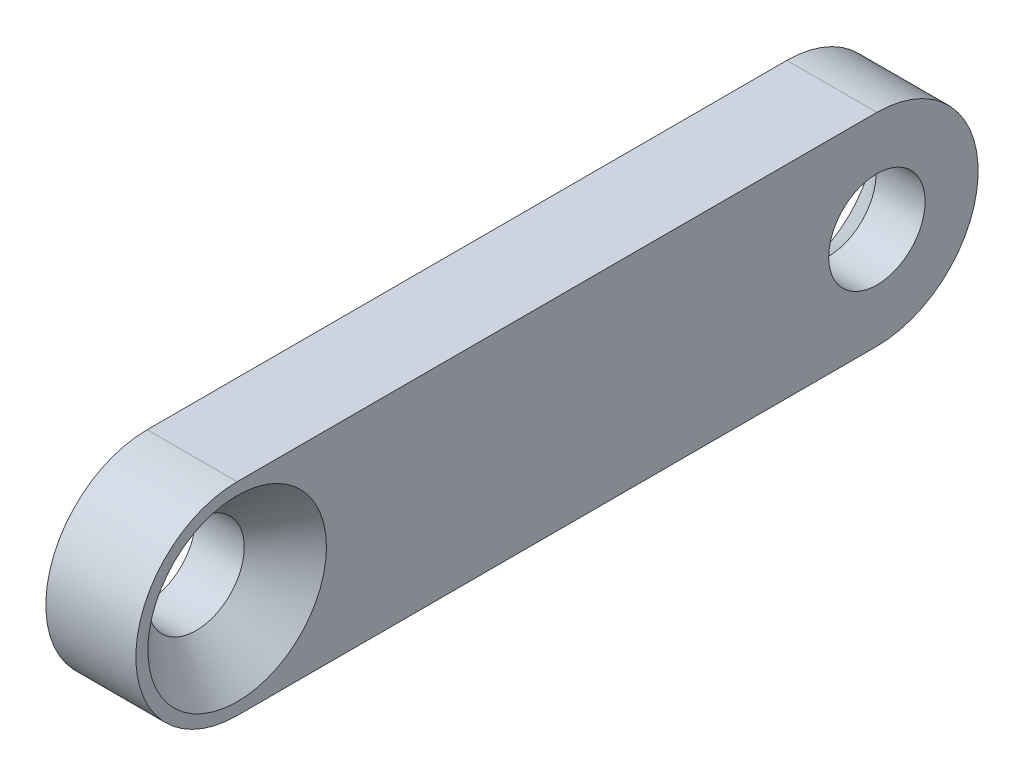
from build123d import *

# Parameters (mm, degrees)
BOSS_EXTRUDE1_DEPTH                             = 3.175
CSK_FOR_M3_FLAT_HEAD_MACHINE_SCREW1_D           = 3.4
CSK_FOR_M3_FLAT_HEAD_MACHINE_SCREW1_DEPTH       = 7.62
CSK_FOR_M3_FLAT_HEAD_MACHINE_SCREW1_CSINK_D     = 6.3
CSK_FOR_M3_FLAT_HEAD_MACHINE_SCREW1_CSINK_ANGLE = 90
CSK_FOR_M3_FLAT_HEAD_MACHINE_SCREW1_TIP         = 1.021463052
CSK_FOR_M3_FLAT_HEAD_MACHINE_SCREW2_D           = 3.4
CSK_FOR_M3_FLAT_HEAD_MACHINE_SCREW2_DEPTH       = 7.62
CSK_FOR_M3_FLAT_HEAD_MACHINE_SCREW2_CSINK_D     = 6.3
CSK_FOR_M3_FLAT_HEAD_MACHINE_SCREW2_CSINK_ANGLE = 90
CSK_FOR_M3_FLAT_HEAD_MACHINE_SCREW2_TIP         = 1.021463052


with BuildPart() as part:
    # Sketch1 → Boss-Extrude1 (new body)
    with BuildSketch(Plane(origin=(0, 0, 0), x_dir=(0, 0, -1), z_dir=(1, 0, 0))):
        with BuildLine():
            Line((-11.281730167, 3.571875), (11.281730167, 3.571875))
            ThreePointArc((11.281730167, 3.571875), (14.853605167, 0), (11.281730167, -3.571875))
            Line((11.281730167, -3.571875), (-11.281730167, -3.571875))
            ThreePointArc((-11.281730167, -3.571875), (-14.853605167, 0), (-11.281730167, 3.571875))
        make_face()
    extrude(amount=BOSS_EXTRUDE1_DEPTH)

    # CSK for M3 Flat Head Machine Screw1
    with Locations(Plane.ZY):
        with Locations((-11.281730167, 0)):
            CounterSinkHole(CSK_FOR_M3_FLAT_HEAD_MACHINE_SCREW1_D / 2, CSK_FOR_M3_FLAT_HEAD_MACHINE_SCREW1_CSINK_D / 2, depth=CSK_FOR_M3_FLAT_HEAD_MACHINE_SCREW1_DEPTH, counter_sink_angle=CSK_FOR_M3_FLAT_HEAD_MACHINE_SCREW1_CSINK_ANGLE)
            with Locations((0, 0, -(CSK_FOR_M3_FLAT_HEAD_MACHINE_SCREW1_DEPTH + CSK_FOR_M3_FLAT_HEAD_MACHINE_SCREW1_TIP / 2))):  # 118° drill point
                Cone(0, CSK_FOR_M3_FLAT_HEAD_MACHINE_SCREW1_D / 2, CSK_FOR_M3_FLAT_HEAD_MACHINE_SCREW1_TIP, mode=Mode.SUBTRACT)

    # CSK for M3 Flat Head Machine Screw2
    with Locations(Plane(origin=(3.175, 0, 0), x_dir=(0, 0, -1), z_dir=(1, 0, 0))):
        with Locations((-11.281730167, 0)):
            CounterSinkHole(CSK_FOR_M3_FLAT_HEAD_MACHINE_SCREW2_D / 2, CSK_FOR_M3_FLAT_HEAD_MACHINE_SCREW2_CSINK_D / 2, depth=CSK_FOR_M3_FLAT_HEAD_MACHINE_SCREW2_DEPTH, counter_sink_angle=CSK_FOR_M3_FLAT_HEAD_MACHINE_SCREW2_CSINK_ANGLE)
            with Locations((0, 0, -(CSK_FOR_M3_FLAT_HEAD_MACHINE_SCREW2_DEPTH + CSK_FOR_M3_FLAT_HEAD_MACHINE_SCREW2_TIP / 2))):  # 118° drill point
                Cone(0, CSK_FOR_M3_FLAT_HEAD_MACHINE_SCREW2_D / 2, CSK_FOR_M3_FLAT_HEAD_MACHINE_SCREW2_TIP, mode=Mode.SUBTRACT)


solid = part.part
